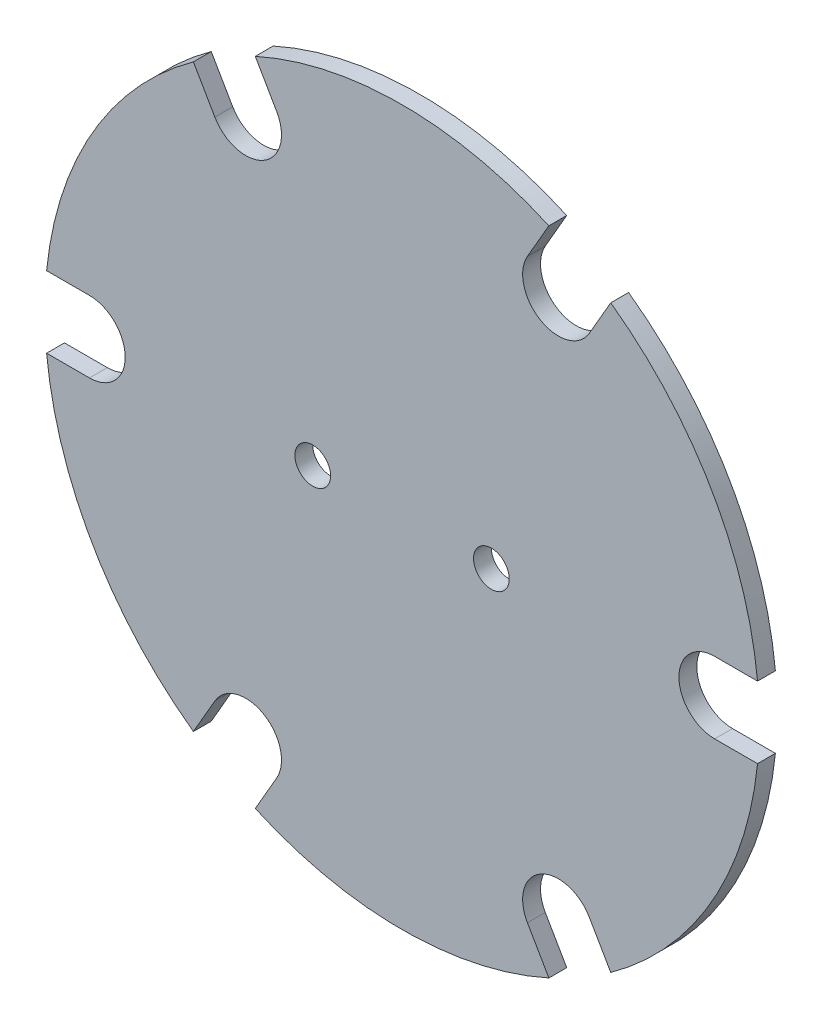
from build123d import *

# Parameters (mm, degrees)
SKETCH_1_R      = 2
EXTRUDE_1_DEPTH = 2


with BuildPart() as part:
    # 草图1 → 凸台-拉伸1 (new body)
    with BuildSketch(Plane.XY):
        with BuildLine():
            Line((-35, 4), (-39.799497484, 4))
            ThreePointArc((-39.799497484, 4), (-34.641016151, 20), (-23.363850357, 32.467375879))
            Line((-23.363850357, 32.467375879), (-20.964101615, 28.310889132))
            ThreePointArc((-20.964101615, 28.310889132), (-15.5, 26.846787517), (-14.035898385, 32.310889132))
            Line((-14.035898385, 32.310889132), (-16.435647127, 36.467375879))
            ThreePointArc((-16.435647127, 36.467375879), (0, 40), (16.435647127, 36.467375879))
            Line((16.435647127, 36.467375879), (14.035898385, 32.310889132))
            ThreePointArc((14.035898385, 32.310889132), (15.5, 26.846787517), (20.964101615, 28.310889132))
            Line((20.964101615, 28.310889132), (23.363850357, 32.467375879))
            ThreePointArc((23.363850357, 32.467375879), (34.641016151, 20), (39.799497484, 4))
            Line((39.799497484, 4), (35, 4))
            ThreePointArc((35, 4), (31, 0), (35, -4))
            Line((35, -4), (39.799497484, -4))
            ThreePointArc((39.799497484, -4), (34.641016151, -20), (23.363850357, -32.467375879))
            Line((23.363850357, -32.467375879), (20.964101615, -28.310889132))
            ThreePointArc((20.964101615, -28.310889132), (15.5, -26.846787517), (14.035898385, -32.310889132))
            Line((14.035898385, -32.310889132), (16.435647127, -36.467375879))
            ThreePointArc((16.435647127, -36.467375879), (0, -40), (-16.435647127, -36.467375879))
            Line((-16.435647127, -36.467375879), (-14.035898385, -32.310889132))
            ThreePointArc((-14.035898385, -32.310889132), (-15.5, -26.846787517), (-20.964101615, -28.310889132))
            Line((-20.964101615, -28.310889132), (-23.363850357, -32.467375879))
            ThreePointArc((-23.363850357, -32.467375879), (-34.641016151, -20), (-39.799497484, -4))
            Line((-39.799497484, -4), (-35, -4))
            ThreePointArc((-35, -4), (-31, 0), (-35, 4))
        make_face()
        with Locations((-10, 0)):
            Circle(SKETCH_1_R, mode=Mode.SUBTRACT)
        with Locations((10, 0)):
            Circle(SKETCH_1_R, mode=Mode.SUBTRACT)
    extrude(amount=EXTRUDE_1_DEPTH)


solid = part.part
